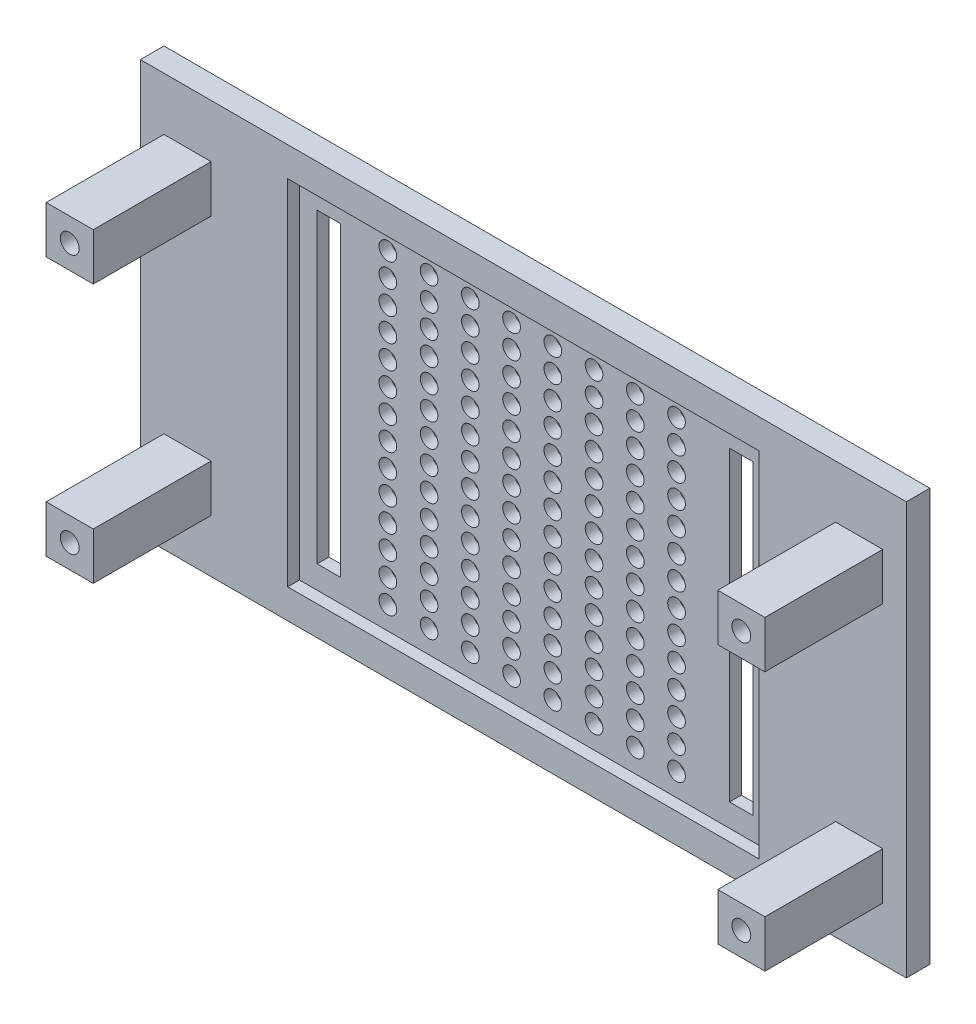
from build123d import *

# Parameters (mm, degrees)
SKETCH1_W           = 65
SKETCH1_H           = 35
BOSS_EXTRUDE1_DEPTH = 2
SKETCH2_W           = 4
SKETCH2_H           = 4
BOSS_EXTRUDE2_DEPTH = 10
SKETCH3_R           = 0.8
CUT_EXTRUDE1_DEPTH  = 5
SKETCH4_R           = 0.75
SKETCH4_W           = 2
SKETCH4_H           = 26
CUT_EXTRUDE2_DEPTH  = 5
SKETCH5_W           = 40
SKETCH5_H           = 30
CUT_EXTRUDE3_DEPTH  = 1


with BuildPart() as part:
    # Sketch1 → Boss-Extrude1 (new body)
    with BuildSketch(Plane.XY):
        Rectangle(SKETCH1_W, SKETCH1_H)
    extrude(amount=BOSS_EXTRUDE1_DEPTH)

    # Sketch2 → Boss-Extrude2 (add)
    with BuildSketch(Plane.XY.offset(2)):
        with Locations((-28.5, 11)):
            Rectangle(SKETCH2_W, SKETCH2_H)
        with Locations((-28.5, -11)):
            Rectangle(SKETCH2_W, SKETCH2_H)
        with Locations((28.5, -11)):
            Rectangle(SKETCH2_W, SKETCH2_H)
        with Locations((28.5, 11)):
            Rectangle(SKETCH2_W, SKETCH2_H)
    extrude(amount=BOSS_EXTRUDE2_DEPTH)

    # Sketch3 → Cut-Extrude1 (cut)
    with BuildSketch(Plane.XY.offset(12)):
        with Locations((28.5, -11)):
            Circle(SKETCH3_R)
        with Locations((28.5, 11)):
            Circle(SKETCH3_R)
        with Locations((-28.5, -11)):
            Circle(SKETCH3_R)
        with Locations((-28.5, 11)):
            Circle(SKETCH3_R)
    extrude(amount=-CUT_EXTRUDE1_DEPTH, mode=Mode.SUBTRACT)

    # Sketch4 → Cut-Extrude2 (cut)
    with BuildSketch(Plane.XY.offset(2)):
        with Locations((-12.5, 12.938911497)):
            Circle(SKETCH4_R)
        with Locations((-12.5, 10.938911497)):
            Circle(SKETCH4_R)
        with Locations((-12.5, 8.938911497)):
            Circle(SKETCH4_R)
        with Locations((-12.5, 6.938911497)):
            Circle(SKETCH4_R)
        with Locations((-12.5, 4.938911497)):
            Circle(SKETCH4_R)
        with Locations((-12.5, 2.938911497)):
            Circle(SKETCH4_R)
        with Locations((-12.5, 0.938911497)):
            Circle(SKETCH4_R)
        with Locations((-12.5, -1.061088503)):
            Circle(SKETCH4_R)
        with Locations((-12.5, -3.061088503)):
            Circle(SKETCH4_R)
        with Locations((-12.5, -5.061088503)):
            Circle(SKETCH4_R)
        with Locations((-12.5, -7.061088503)):
            Circle(SKETCH4_R)
        with Locations((-12.5, -9.061088503)):
            Circle(SKETCH4_R)
        with Locations((-12.5, -11.061088503)):
            Circle(SKETCH4_R)
        with Locations((-12.5, -13.061088503)):
            Circle(SKETCH4_R)
        with Locations((-9, 12.938911497)):
            Circle(SKETCH4_R)
        with Locations((-9, 10.938911497)):
            Circle(SKETCH4_R)
        with Locations((-9, 8.938911497)):
            Circle(SKETCH4_R)
        with Locations((-9, 6.938911497)):
            Circle(SKETCH4_R)
        with Locations((-9, 4.938911497)):
            Circle(SKETCH4_R)
        with Locations((-9, 2.938911497)):
            Circle(SKETCH4_R)
        with Locations((-9, 0.938911497)):
            Circle(SKETCH4_R)
        with Locations((-9, -1.061088503)):
            Circle(SKETCH4_R)
        with Locations((-9, -3.061088503)):
            Circle(SKETCH4_R)
        with Locations((-9, -5.061088503)):
            Circle(SKETCH4_R)
        with Locations((-9, -7.061088503)):
            Circle(SKETCH4_R)
        with Locations((-9, -9.061088503)):
            Circle(SKETCH4_R)
        with Locations((-9, -11.061088503)):
            Circle(SKETCH4_R)
        with Locations((-9, -13.061088503)):
            Circle(SKETCH4_R)
        with Locations((-5.5, 12.938911497)):
            Circle(SKETCH4_R)
        with Locations((-5.5, 10.938911497)):
            Circle(SKETCH4_R)
        with Locations((-5.5, 8.938911497)):
            Circle(SKETCH4_R)
        with Locations((-5.5, 6.938911497)):
            Circle(SKETCH4_R)
        with Locations((-5.5, 4.938911497)):
            Circle(SKETCH4_R)
        with Locations((-5.5, 2.938911497)):
            Circle(SKETCH4_R)
        with Locations((-5.5, 0.938911497)):
            Circle(SKETCH4_R)
        with Locations((-5.5, -1.061088503)):
            Circle(SKETCH4_R)
        with Locations((-5.5, -3.061088503)):
            Circle(SKETCH4_R)
        with Locations((-5.5, -5.061088503)):
            Circle(SKETCH4_R)
        with Locations((-5.5, -7.061088503)):
            Circle(SKETCH4_R)
        with Locations((-5.5, -9.061088503)):
            Circle(SKETCH4_R)
        with Locations((-5.5, -11.061088503)):
            Circle(SKETCH4_R)
        with Locations((-5.5, -13.061088503)):
            Circle(SKETCH4_R)
        with Locations((-2, 12.938911497)):
            Circle(SKETCH4_R)
        with Locations((-2, 10.938911497)):
            Circle(SKETCH4_R)
        with Locations((-2, 8.938911497)):
            Circle(SKETCH4_R)
        with Locations((-2, 6.938911497)):
            Circle(SKETCH4_R)
        with Locations((-2, 4.938911497)):
            Circle(SKETCH4_R)
        with Locations((-2, 2.938911497)):
            Circle(SKETCH4_R)
        with Locations((-2, 0.938911497)):
            Circle(SKETCH4_R)
        with Locations((-2, -1.061088503)):
            Circle(SKETCH4_R)
        with Locations((-2, -3.061088503)):
            Circle(SKETCH4_R)
        with Locations((-2, -5.061088503)):
            Circle(SKETCH4_R)
        with Locations((-2, -7.061088503)):
            Circle(SKETCH4_R)
        with Locations((-2, -9.061088503)):
            Circle(SKETCH4_R)
        with Locations((-2, -11.061088503)):
            Circle(SKETCH4_R)
        with Locations((-2, -13.061088503)):
            Circle(SKETCH4_R)
        with Locations((1.5, 12.938911497)):
            Circle(SKETCH4_R)
        with Locations((1.5, 10.938911497)):
            Circle(SKETCH4_R)
        with Locations((1.5, 8.938911497)):
            Circle(SKETCH4_R)
        with Locations((1.5, 6.938911497)):
            Circle(SKETCH4_R)
        with Locations((1.5, 4.938911497)):
            Circle(SKETCH4_R)
        with Locations((1.5, 2.938911497)):
            Circle(SKETCH4_R)
        with Locations((1.5, 0.938911497)):
            Circle(SKETCH4_R)
        with Locations((1.5, -1.061088503)):
            Circle(SKETCH4_R)
        with Locations((1.5, -3.061088503)):
            Circle(SKETCH4_R)
        with Locations((1.5, -5.061088503)):
            Circle(SKETCH4_R)
        with Locations((1.5, -7.061088503)):
            Circle(SKETCH4_R)
        with Locations((1.5, -9.061088503)):
            Circle(SKETCH4_R)
        with Locations((1.5, -11.061088503)):
            Circle(SKETCH4_R)
        with Locations((1.5, -13.061088503)):
            Circle(SKETCH4_R)
        with Locations((5, 12.938911497)):
            Circle(SKETCH4_R)
        with Locations((5, 10.938911497)):
            Circle(SKETCH4_R)
        with Locations((5, 8.938911497)):
            Circle(SKETCH4_R)
        with Locations((5, 6.938911497)):
            Circle(SKETCH4_R)
        with Locations((5, 4.938911497)):
            Circle(SKETCH4_R)
        with Locations((5, 2.938911497)):
            Circle(SKETCH4_R)
        with Locations((5, 0.938911497)):
            Circle(SKETCH4_R)
        with Locations((5, -1.061088503)):
            Circle(SKETCH4_R)
        with Locations((5, -3.061088503)):
            Circle(SKETCH4_R)
        with Locations((5, -5.061088503)):
            Circle(SKETCH4_R)
        with Locations((5, -7.061088503)):
            Circle(SKETCH4_R)
        with Locations((5, -9.061088503)):
            Circle(SKETCH4_R)
        with Locations((5, -11.061088503)):
            Circle(SKETCH4_R)
        with Locations((5, -13.061088503)):
            Circle(SKETCH4_R)
        with Locations((8.5, 12.938911497)):
            Circle(SKETCH4_R)
        with Locations((8.5, 10.938911497)):
            Circle(SKETCH4_R)
        with Locations((8.5, 8.938911497)):
            Circle(SKETCH4_R)
        with Locations((8.5, 6.938911497)):
            Circle(SKETCH4_R)
        with Locations((8.5, 4.938911497)):
            Circle(SKETCH4_R)
        with Locations((8.5, 2.938911497)):
            Circle(SKETCH4_R)
        with Locations((8.5, 0.938911497)):
            Circle(SKETCH4_R)
        with Locations((8.5, -1.061088503)):
            Circle(SKETCH4_R)
        with Locations((8.5, -3.061088503)):
            Circle(SKETCH4_R)
        with Locations((8.5, -5.061088503)):
            Circle(SKETCH4_R)
        with Locations((8.5, -7.061088503)):
            Circle(SKETCH4_R)
        with Locations((8.5, -9.061088503)):
            Circle(SKETCH4_R)
        with Locations((8.5, -11.061088503)):
            Circle(SKETCH4_R)
        with Locations((8.5, -13.061088503)):
            Circle(SKETCH4_R)
        with Locations((12, 12.938911497)):
            Circle(SKETCH4_R)
        with Locations((12, 10.938911497)):
            Circle(SKETCH4_R)
        with Locations((12, 8.938911497)):
            Circle(SKETCH4_R)
        with Locations((12, 6.938911497)):
            Circle(SKETCH4_R)
        with Locations((12, 4.938911497)):
            Circle(SKETCH4_R)
        with Locations((12, 2.938911497)):
            Circle(SKETCH4_R)
        with Locations((12, 0.938911497)):
            Circle(SKETCH4_R)
        with Locations((12, -1.061088503)):
            Circle(SKETCH4_R)
        with Locations((12, -3.061088503)):
            Circle(SKETCH4_R)
        with Locations((12, -5.061088503)):
            Circle(SKETCH4_R)
        with Locations((12, -7.061088503)):
            Circle(SKETCH4_R)
        with Locations((12, -9.061088503)):
            Circle(SKETCH4_R)
        with Locations((12, -11.061088503)):
            Circle(SKETCH4_R)
        with Locations((12, -13.061088503)):
            Circle(SKETCH4_R)
        with Locations((-17.5, -0.061088503)):
            Rectangle(SKETCH4_W, SKETCH4_H)
        with Locations((17.5, -0.061088503)):
            Rectangle(SKETCH4_W, SKETCH4_H)
    extrude(amount=-CUT_EXTRUDE2_DEPTH, mode=Mode.SUBTRACT)

    # Sketch5 → Cut-Extrude3 (cut)
    with BuildSketch(Plane.XY.offset(2)):
        Rectangle(SKETCH5_W, SKETCH5_H)
    extrude(amount=-CUT_EXTRUDE3_DEPTH, mode=Mode.SUBTRACT)


solid = part.part
